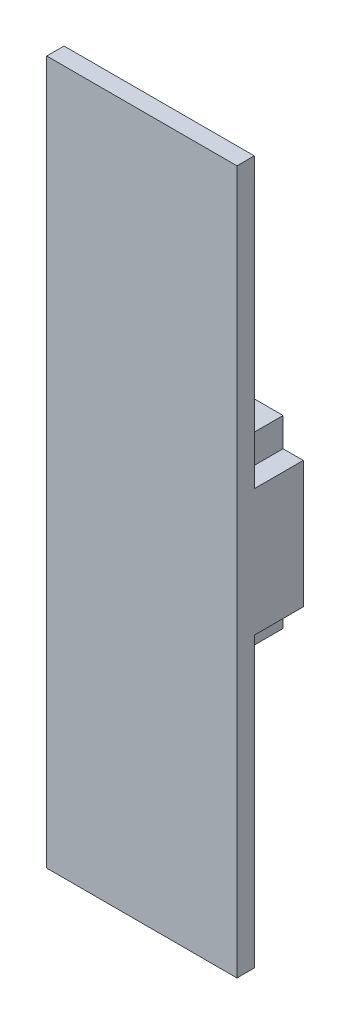
from build123d import *

# Parameters (mm, degrees)
BOSS_EXTRUDE1_DEPTH = 2.5
SKETCH_1_W          = 33
SKETCH_1_H          = 22
EXTRUDE_1_DEPTH     = 6.5
SKETCH_2_W          = 33
SKETCH_2_H          = 3
EXTRUDE_2_DEPTH     = 50


with BuildPart() as part:
    # Sketch1 → Boss-Extrude1 (new, symmetric)
    with BuildSketch(Plane.XY):
        Polygon((-13, 11), (-16.5, 11), (-16.5, -11), (-13, -11), (-13, -16), (-5, -16), (-5, -11), (5, -11), (5, -16), (13, -16), (13, -11), (16.5, -11), (16.5, 11), (13, 11), (13, 16), (5, 16), (5, 11), (-5, 11), (-5, 16), (-13, 16), align=None)
    extrude(amount=BOSS_EXTRUDE1_DEPTH, both=True)

    # 草图1 → 凸台-拉伸1 (add)
    with BuildSketch(Plane.XY.offset(2.5)):
        Rectangle(SKETCH_1_W, SKETCH_1_H)
    extrude(amount=EXTRUDE_1_DEPTH)

    # 草图2 → 凸台-拉伸2 (add)
    with BuildSketch(Plane(origin=(0, 11, 0), x_dir=(1, 0, 0), z_dir=(0, 1, 0))):
        with Locations((0, -7.5)):
            Rectangle(SKETCH_2_W, SKETCH_2_H)
    extrude_2 = extrude(amount=EXTRUDE_2_DEPTH)

    # 镜向1: 凸台-拉伸2 across plane
    add(extrude_2.mirror(Plane.ZX))


solid = part.part
